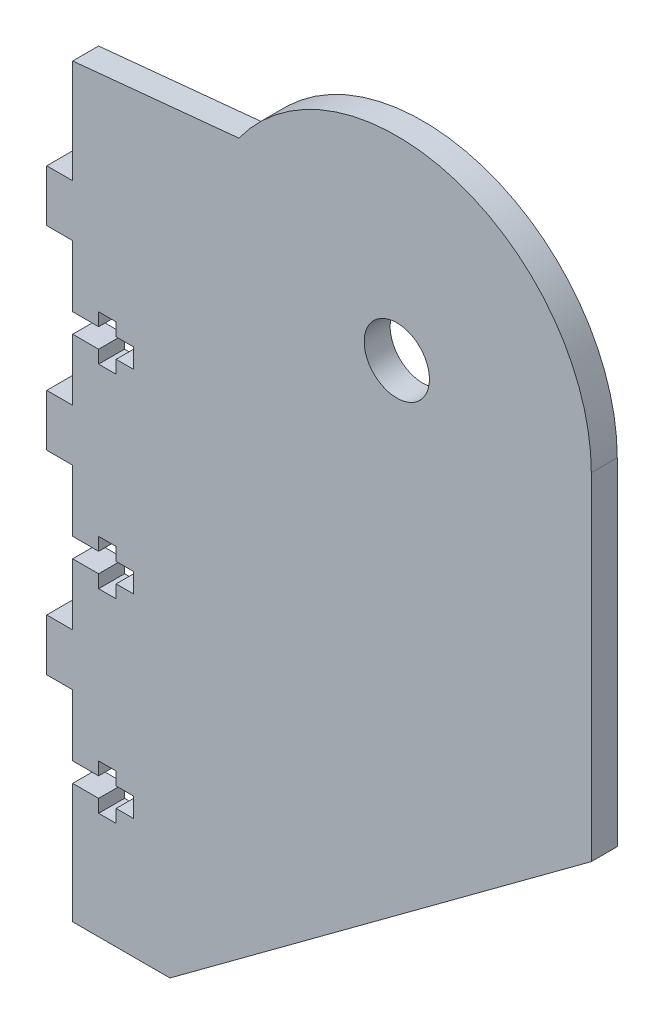
from build123d import *

# Parameters (mm, degrees)
SKETCH_1_R      = 5.03
EXTRUDE_1_DEPTH = 4


with BuildPart() as part:
    # 草图1 → 凸台-拉伸1 (new body)
    with BuildSketch(Plane.XY):
        with BuildLine():
            Line((298.542857143, -51.645714286), (302.542857143, -51.645714286))
            Line((302.542857143, -51.645714286), (302.542857143, -53.644175919))
            Line((302.542857143, -53.644175919), (305.242857143, -53.644175919))
            Line((305.242857143, -53.644175919), (305.242857143, -51.645714286))
            Line((305.242857143, -51.645714286), (307.942857143, -51.645714286))
            Line((307.942857143, -51.645714286), (307.942857143, -48.645714286))
            Line((307.942857143, -48.645714286), (305.242857143, -48.645714286))
            Line((305.242857143, -48.645714286), (305.242857143, -46.647252653))
            Line((305.242857143, -46.647252653), (302.542857143, -46.647252653))
            Line((302.542857143, -46.647252653), (302.542857143, -48.645714286))
            Line((302.542857143, -48.645714286), (298.542857143, -48.645714286))
            Line((298.542857143, -48.645714286), (298.542857143, -39.145714286))
            Line((298.542857143, -39.145714286), (294.542857143, -39.145714286))
            Line((294.542857143, -39.145714286), (294.542857143, -31.145714286))
            Line((294.542857143, -31.145714286), (298.542857143, -31.145714286))
            Line((298.542857143, -31.145714286), (298.542857143, -21.645714286))
            Line((298.542857143, -21.645714286), (302.542857143, -21.645714286))
            Line((302.542857143, -21.645714286), (302.542857143, -23.644175919))
            Line((302.542857143, -23.644175919), (305.242857143, -23.644175919))
            Line((305.242857143, -23.644175919), (305.242857143, -21.645714286))
            Line((305.242857143, -21.645714286), (307.942857143, -21.645714286))
            Line((307.942857143, -21.645714286), (307.942857143, -18.645714286))
            Line((307.942857143, -18.645714286), (305.242857143, -18.645714286))
            Line((305.242857143, -18.645714286), (305.242857143, -16.647252653))
            Line((305.242857143, -16.647252653), (302.542857143, -16.647252653))
            Line((302.542857143, -16.647252653), (302.542857143, -18.645714286))
            Line((302.542857143, -18.645714286), (298.542857143, -18.645714286))
            Line((298.542857143, -18.645714286), (298.542857143, -9.145714286))
            Line((298.542857143, -9.145714286), (294.542857143, -9.145714286))
            Line((294.542857143, -9.145714286), (294.542857143, -1.145714286))
            Line((294.542857143, -1.145714286), (298.542857143, -1.145714286))
            Line((298.542857143, -1.145714286), (298.542857143, -0.145714286))
            Line((298.542857143, -0.145714286), (298.542857143, 14.854285714))
            Line((298.542857143, 14.854285714), (324.186090726, 17.3685065))
            ThreePointArc((324.186090726, 17.3685065), (357.743319291, 28.408646086), (378.542857143, -0.145714286))
            Line((378.542857143, -0.145714286), (378.542857143, -52.102236025))
            Line((378.542857143, -52.102236025), (313.542857143, -100.145714286))
            Line((313.542857143, -100.145714286), (298.542857143, -100.145714286))
            Line((298.542857143, -100.145714286), (298.542857143, -81.645714286))
            Line((298.542857143, -81.645714286), (302.542857143, -81.645714286))
            Line((302.542857143, -81.645714286), (302.542857143, -83.644175919))
            Line((302.542857143, -83.644175919), (305.242857143, -83.644175919))
            Line((305.242857143, -83.644175919), (305.242857143, -81.645714286))
            Line((305.242857143, -81.645714286), (307.942857143, -81.645714286))
            Line((307.942857143, -81.645714286), (307.942857143, -78.645714286))
            Line((307.942857143, -78.645714286), (305.242857143, -78.645714286))
            Line((305.242857143, -78.645714286), (305.242857143, -76.647252653))
            Line((305.242857143, -76.647252653), (302.542857143, -76.647252653))
            Line((302.542857143, -76.647252653), (302.542857143, -78.645714286))
            Line((302.542857143, -78.645714286), (298.542857143, -78.645714286))
            Line((298.542857143, -78.645714286), (298.542857143, -69.145714286))
            Line((298.542857143, -69.145714286), (294.542857143, -69.145714286))
            Line((294.542857143, -69.145714286), (294.542857143, -61.145714286))
            Line((294.542857143, -61.145714286), (298.542857143, -61.145714286))
            Line((298.542857143, -61.145714286), (298.542857143, -51.645714286))
        make_face()
        with Locations((348.542857143, -0.145714286)):
            Circle(SKETCH_1_R, mode=Mode.SUBTRACT)
    extrude(amount=EXTRUDE_1_DEPTH)


solid = part.part
